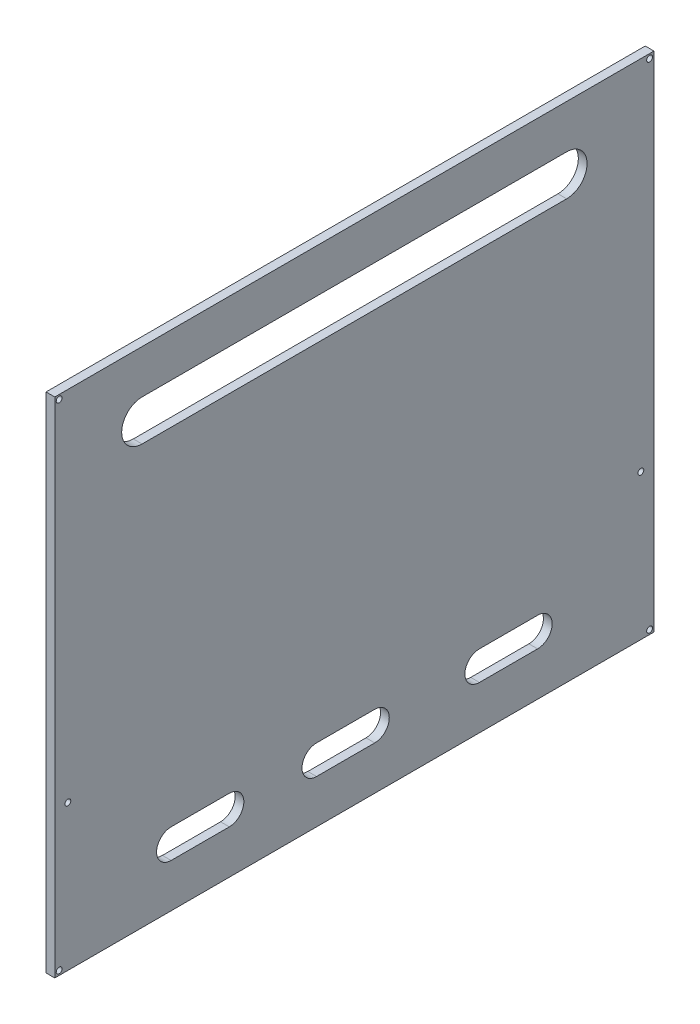
from build123d import *

# Parameters (mm, degrees)
SKETCH1_W           = 206
SKETCH1_H           = 173
SKETCH1_R           = 1
BOSS_EXTRUDE1_DEPTH = 3


with BuildPart() as part:
    # Sketch1 → Boss-Extrude1 (new body)
    with BuildSketch(Plane(origin=(0, 0, 0), x_dir=(0, 0, -1), z_dir=(1, 0, 0))):
        with Locations((103, 86.5)):
            Rectangle(SKETCH1_W, SKETCH1_H)
        with Locations((204.5, 171.5)):
            Circle(SKETCH1_R, mode=Mode.SUBTRACT)
        with Locations((204.5, 1.5)):
            Circle(SKETCH1_R, mode=Mode.SUBTRACT)
        with Locations((1.5, 171.5)):
            Circle(SKETCH1_R, mode=Mode.SUBTRACT)
        with Locations((1.5, 1.5)):
            Circle(SKETCH1_R, mode=Mode.SUBTRACT)
        with Locations((201.5, 50)):
            Circle(SKETCH1_R, mode=Mode.SUBTRACT)
        with Locations((4.5, 50)):
            Circle(SKETCH1_R, mode=Mode.SUBTRACT)
        with BuildLine():
            Line((30, 158), (176, 158))
            ThreePointArc((176, 158), (183, 151), (176, 144))
            Line((176, 144), (30, 144))
            ThreePointArc((30, 144), (23, 151), (30, 158))
        make_face(mode=Mode.SUBTRACT)
        with BuildLine():
            Line((40, 25), (60, 25))
            ThreePointArc((60, 25), (65, 20), (60, 15))
            Line((60, 15), (40, 15))
            ThreePointArc((40, 15), (35, 20), (40, 25))
        make_face(mode=Mode.SUBTRACT)
        with BuildLine():
            Line((90, 25), (110, 25))
            ThreePointArc((110, 25), (115, 20), (110, 15))
            Line((110, 15), (90, 15))
            ThreePointArc((90, 15), (85, 20), (90, 25))
        make_face(mode=Mode.SUBTRACT)
        with BuildLine():
            Line((146, 25), (166, 25))
            ThreePointArc((166, 25), (171, 20), (166, 15))
            Line((166, 15), (146, 15))
            ThreePointArc((146, 15), (141, 20), (146, 25))
        make_face(mode=Mode.SUBTRACT)
    extrude(amount=BOSS_EXTRUDE1_DEPTH)


solid = part.part
